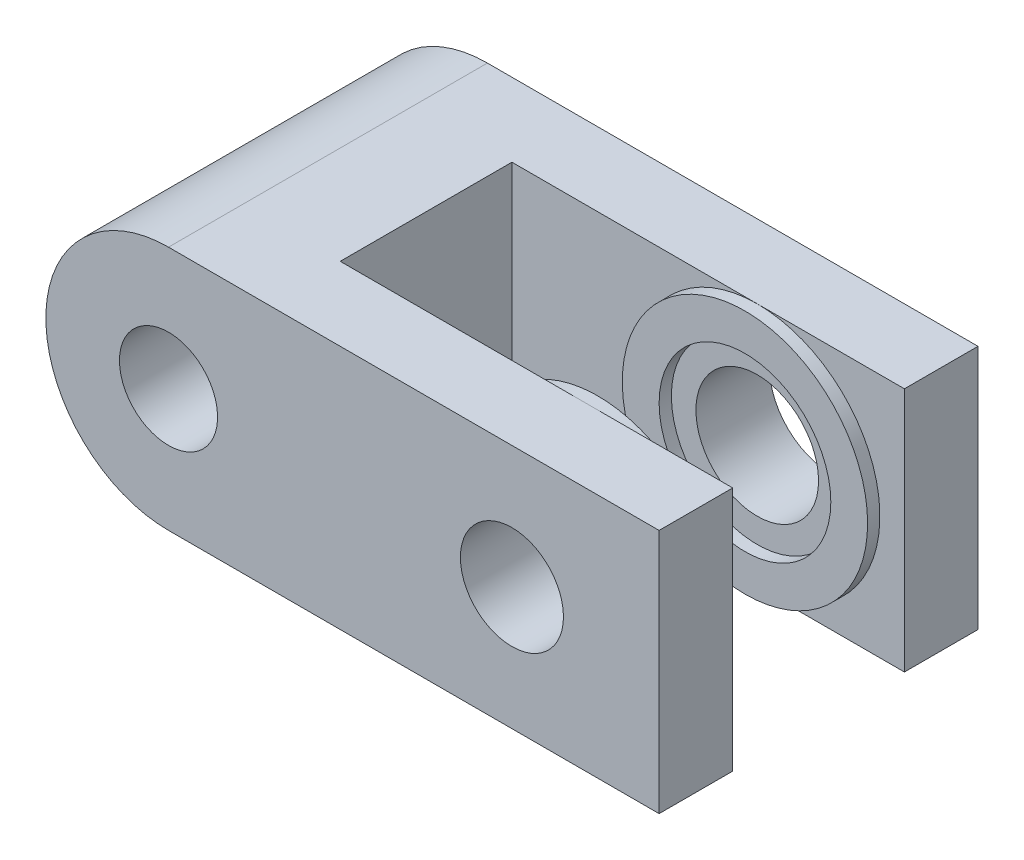
from build123d import *

# Parameters (mm, degrees)
AUFSATZ_LINEAR_AUSTRAGEN1_DEPTH = 13
SKIZZE2_W                       = 16
SKIZZE2_H                       = 7
SCHNITT_LINEAR_AUSTRAGEN1_DEPTH = 10
SKIZZE4_R                       = 2.5
SCHNITT_LINEAR_AUSTRAGEN2_DEPTH = 3
SKIZZE5_R                       = 3.5
SKIZZE5_R_2                     = 2
SCHNITT_LINEAR_AUSTRAGEN3_DEPTH = 4
SKIZZE6_R                       = 2.1
SCHNITT_LINEAR_AUSTRAGEN4_DEPTH = 4
SKIZZE7_R                       = 5
SKIZZE7_R_2                     = 3.5
AUFSATZ_LINEAR_AUSTRAGEN2_DEPTH = 0.5
AUFSATZ_LINEAR_START            = 0.5
SKIZZE8_R                       = 5
SKIZZE8_R_2                     = 2.1
AUFSATZ_LINEAR_AUSTRAGEN3_DEPTH = 0.5


with BuildPart() as part:
    # Skizze1 → Aufsatz-Linear austragen1 (new body)
    with BuildSketch(Plane.XY):
        with BuildLine():
            ThreePointArc((5, 0), (3.535533906, 3.535533906), (0, 5))
            Line((0, 5), (0, 2))
            ThreePointArc((0, 2), (1.414213562, 1.414213562), (2, 0))
            ThreePointArc((2, 0), (1.414213562, -1.414213562), (0, -2))
            Line((0, -2), (0, -5))
            ThreePointArc((0, -5), (3.535533906, -3.535533906), (5, 0))
        make_face()
        with BuildLine():
            Line((0, 2), (0, 5))
            ThreePointArc((0, 5), (-5, 0), (0, -5))
            Line((0, -5), (0, -2))
            ThreePointArc((0, -2), (-2, 0), (0, 2))
        make_face()
        with BuildLine():
            Line((20, 5), (0, 5))
            ThreePointArc((0, 5), (3.535533906, 3.535533906), (5, 0))
            ThreePointArc((5, 0), (3.535533906, -3.535533906), (0, -5))
            Line((0, -5), (20, -5))
            Line((20, -5), (20, 5))
        make_face()
    extrude(amount=AUFSATZ_LINEAR_AUSTRAGEN1_DEPTH)

    # Skizze2 → Schnitt-Linear austragen1 (cut)
    with BuildSketch(Plane(origin=(0, 5, 0), x_dir=(1, 0, 0), z_dir=(0, 1, 0))):
        with Locations((12, -6.5)):
            Rectangle(SKIZZE2_W, SKIZZE2_H)
    extrude(amount=-SCHNITT_LINEAR_AUSTRAGEN1_DEPTH, mode=Mode.SUBTRACT)

    # Skizze4 → Schnitt-Linear austragen2 (cut)
    with BuildSketch(Plane.XY.offset(3)):
        with Locations((14, 0)):
            Circle(SKIZZE4_R)
    extrude(amount=-SCHNITT_LINEAR_AUSTRAGEN2_DEPTH, mode=Mode.SUBTRACT)

    # Skizze5 → Schnitt-Linear austragen3 (cut)
    with BuildSketch(Plane(origin=(0, 0, 0), x_dir=(-1, 0, 0), z_dir=(0, 0, -1))):
        Circle(SKIZZE5_R)
        Circle(SKIZZE5_R_2, mode=Mode.SUBTRACT)
    extrude(amount=-SCHNITT_LINEAR_AUSTRAGEN3_DEPTH, mode=Mode.SUBTRACT)

    # Skizze6 → Schnitt-Linear austragen4 (cut)
    with BuildSketch(Plane(origin=(0, 0, 10), x_dir=(-1, 0, 0), z_dir=(0, 0, -1))):
        with Locations((-14, 0)):
            Circle(SKIZZE6_R)
    extrude(amount=-SCHNITT_LINEAR_AUSTRAGEN4_DEPTH, mode=Mode.SUBTRACT)

    # Skizze7 → Aufsatz-Linear austragen2 (add)
    with BuildSketch(Plane.XY.offset(3)):
        with Locations(Location((14, 0, 0), (0, 0, 270))):
            Circle(SKIZZE7_R)
        with Locations((14, 0)):
            Circle(SKIZZE7_R_2, mode=Mode.SUBTRACT)
    extrude(amount=AUFSATZ_LINEAR_AUSTRAGEN2_DEPTH)

    # Skizze8 → Aufsatz-Linear austragen3 (add)
    with BuildSketch(Plane(origin=(0, 0, 10), x_dir=(-1, 0, 0), z_dir=(0, 0, -1)).offset(AUFSATZ_LINEAR_START)):
        with Locations(Location((-14, 0, 0), (0, 0, 270))):
            Circle(SKIZZE8_R)
        with Locations((-14, 0)):
            Circle(SKIZZE8_R_2, mode=Mode.SUBTRACT)
    extrude(amount=-AUFSATZ_LINEAR_AUSTRAGEN3_DEPTH)


solid = part.part
